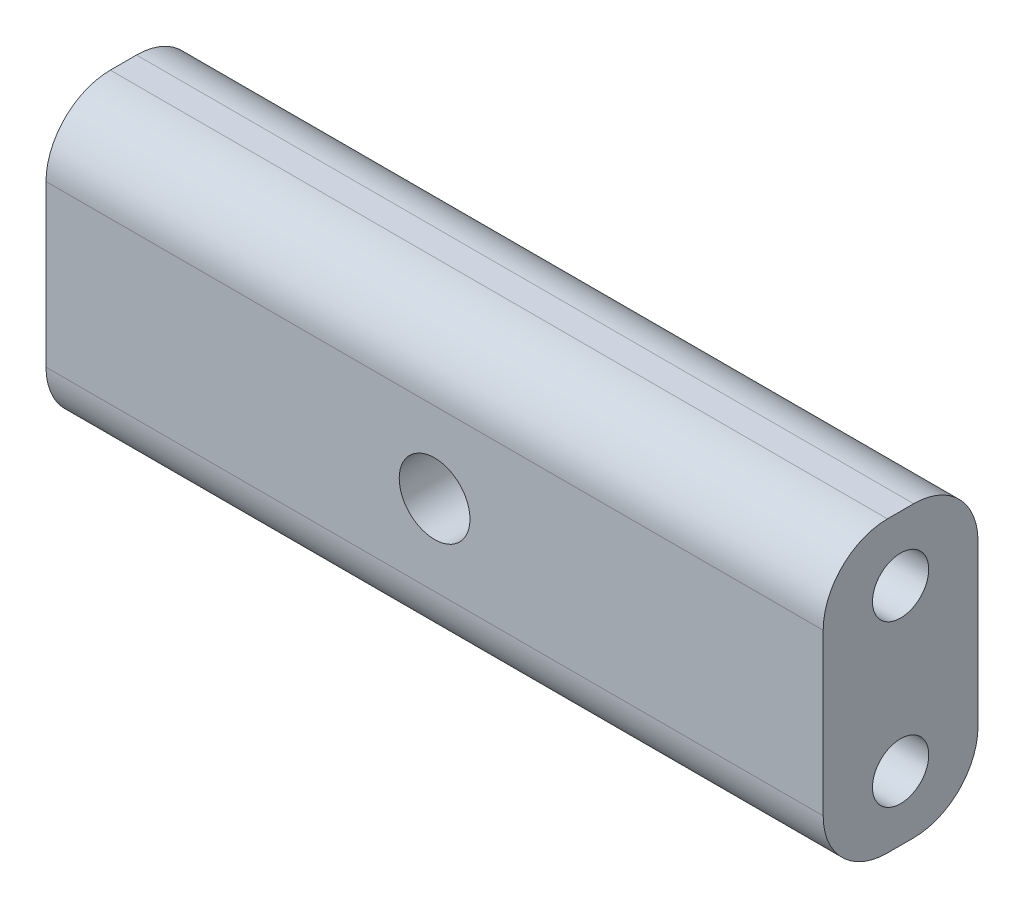
from build123d import *

# Parameters (mm, degrees)
SKETCH1_W         = 48.34
SKETCH1_H         = 18
EXTRUDE_3_8_DEPTH = 9.63
SKETCH2_R         = 1.75
M4_DRILL_DEPTH    = 8
M4_DRILL2_START   = -8
SKETCH3_R         = 1.75
M4_DRILL2_DEPTH   = 8
SKETCH5_R         = 2.2
M5_DRILL_DEPTH    = 9.63
FILLET1_R         = 4


with BuildPart() as part:
    # Sketch1 → 3/8 (new body)
    with BuildSketch(Plane.XY):
        Rectangle(SKETCH1_W, SKETCH1_H)
    extrude(amount=EXTRUDE_3_8_DEPTH)

    # Sketch2 → M4_DRILL (cut)
    with BuildSketch(Plane.ZY.offset(24.17)):
        with Locations((4.815, 5)):
            Circle(SKETCH2_R)
        with Locations(Location((4.815, -5, 0), (0, 0, 180))):
            Circle(SKETCH2_R)
    extrude(amount=-M4_DRILL_DEPTH, mode=Mode.SUBTRACT)

    # Sketch3 → M4_DRILL2 (cut)
    with BuildSketch(Plane(origin=(24.17, 0, 0), x_dir=(0, 0, -1), z_dir=(1, 0, 0)).offset(M4_DRILL2_START)):
        with Locations((-4.815, -5)):
            Circle(SKETCH3_R)
        with Locations(Location((-4.815, 5, 0), (0, 0, 180))):
            Circle(SKETCH3_R)
    extrude(amount=M4_DRILL2_DEPTH, mode=Mode.SUBTRACT)

    # Sketch5 → M5_DRILL (cut)
    with BuildSketch(Plane(origin=(0, 0, 0), x_dir=(-1, 0, 0), z_dir=(0, 0, -1))):
        Circle(SKETCH5_R)
    extrude(amount=-M5_DRILL_DEPTH, mode=Mode.SUBTRACT)

    # Fillet1
    fillet1_edges = [part.edges().sort_by_distance(p)[0] for p in [
        (0, -9, 9.63),
        (0, -9, 0),
        (0, 9, 0),
        (0, 9, 9.63),
    ]]
    fillet(fillet1_edges, radius=FILLET1_R)


solid = part.part
